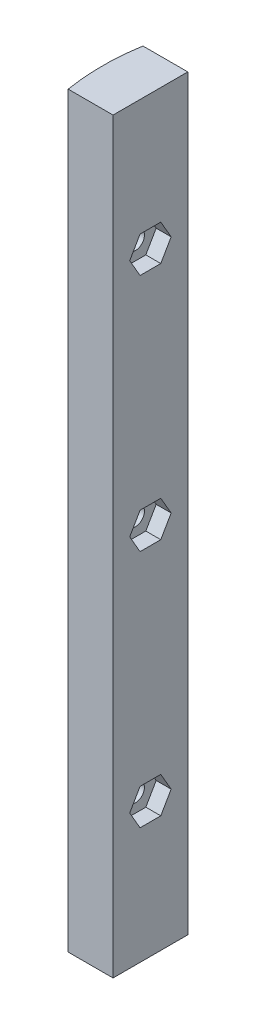
from build123d import *

# Parameters (mm, degrees)
BOSS_EXTRUDE1_DEPTH = 25
SKETCH2_R           = 3
CUT_EXTRUDE1_DEPTH  = 25
SKETCH3_W           = 25
SKETCH3_H           = 25
BOSS_EXTRUDE2_DEPTH = 5
BOSS_EXTRUDE3_DEPTH = 192.5
BOSS_EXTRUDE4_START = 32.5
BOSS_EXTRUDE4_DEPTH = 32.5
LPATTERN4_COUNT     = 3
LPATTERN4_PITCH     = 80
CUT_EXTRUDE2_DEPTH  = 5


with BuildPart() as part:
    # Sketch1 → Boss-Extrude1 (new body)
    with BuildSketch(Plane(origin=(0, 0, 0), x_dir=(1, 0, 0), z_dir=(0, 1, 0))):
        with BuildLine():
            Line((-65.504745346, 11.478381524), (-65.504745346, -13.521618476))
            Line((-65.504745346, -13.521618476), (-75.504745346, -13.521618476))
            ThreePointArc((-75.504745346, -13.521618476), (-76.536999603, -1.021618476), (-75.504745346, 11.478381524))
            Line((-75.504745346, 11.478381524), (-65.504745346, 11.478381524))
        make_face()
    extrude(amount=BOSS_EXTRUDE1_DEPTH)

    # Sketch2 → Cut-Extrude1 (cut)
    with BuildSketch(Plane(origin=(-65.504745346, 0, 0), x_dir=(0, 0, -1), z_dir=(1, 0, 0))):
        with Locations((-1.021618476, 12.5)):
            Circle(SKETCH2_R)
    cut_extrude1 = extrude(amount=-CUT_EXTRUDE1_DEPTH, mode=Mode.SUBTRACT)

    # Sketch3 → Boss-Extrude2 (add)
    with BuildSketch(Plane(origin=(-65.504745346, 0, 0), x_dir=(0, 0, -1), z_dir=(1, 0, 0))):
        with Locations((-1.021618476, 12.5)):
            Rectangle(SKETCH3_W, SKETCH3_H)
        Polygon((5.906584755, 12.5), (2.442483139, 18.5), (-4.485720091, 18.5), (-7.949821706, 12.5), (-4.485720091, 6.5), (2.442483139, 6.5), align=None, mode=Mode.SUBTRACT)
    extrude(amount=BOSS_EXTRUDE2_DEPTH)

    # Sketch4 → Boss-Extrude3 (add)
    with BuildSketch(Plane(origin=(0, 25, 0), x_dir=(1, 0, 0), z_dir=(0, 1, 0))):
        with BuildLine():
            Line((-75.504745346, -13.521618476), (-60.504745346, -13.521618476))
            Line((-60.504745346, -13.521618476), (-60.504745346, 11.478381524))
            Line((-60.504745346, 11.478381524), (-75.504745346, 11.478381524))
            ThreePointArc((-75.504745346, 11.478381524), (-76.536999603, -1.021618476), (-75.504745346, -13.521618476))
        make_face()
    extrude(amount=BOSS_EXTRUDE3_DEPTH)

    # Sketch5 → Boss-Extrude4 (add)
    with BuildSketch(Plane.XZ.offset(BOSS_EXTRUDE4_START)):
        with BuildLine():
            Line((-75.504745346, 13.521618476), (-60.504745346, 13.521618476))
            Line((-60.504745346, 13.521618476), (-60.504745346, -11.478381524))
            Line((-60.504745346, -11.478381524), (-75.504745346, -11.478381524))
            ThreePointArc((-75.504745346, -11.478381524), (-76.536999603, 1.021618476), (-75.504745346, 13.521618476))
        make_face()
    extrude(amount=-BOSS_EXTRUDE4_DEPTH)

    # LPattern4: Cut-Extrude1 ×3
    with Locations(*[(0, i * LPATTERN4_PITCH, 0) for i in range(1, LPATTERN4_COUNT)]):
        add(cut_extrude1, mode=Mode.SUBTRACT)

    # Sketch6 → Cut-Extrude2 (cut)
    with BuildSketch(Plane(origin=(-60.504745346, 0, 0), x_dir=(0, 0, -1), z_dir=(1, 0, 0))):
        Polygon((5.906584755, 92.5), (2.442483139, 98.5), (-4.485720091, 98.5), (-7.949821706, 92.5), (-4.485720091, 86.5), (2.442483139, 86.5), align=None)
        Polygon((5.906584755, 172.5), (2.442483139, 178.5), (-4.485720091, 178.5), (-7.949821706, 172.5), (-4.485720091, 166.5), (2.442483139, 166.5), align=None)
    extrude(amount=-CUT_EXTRUDE2_DEPTH, mode=Mode.SUBTRACT)


solid = part.part
